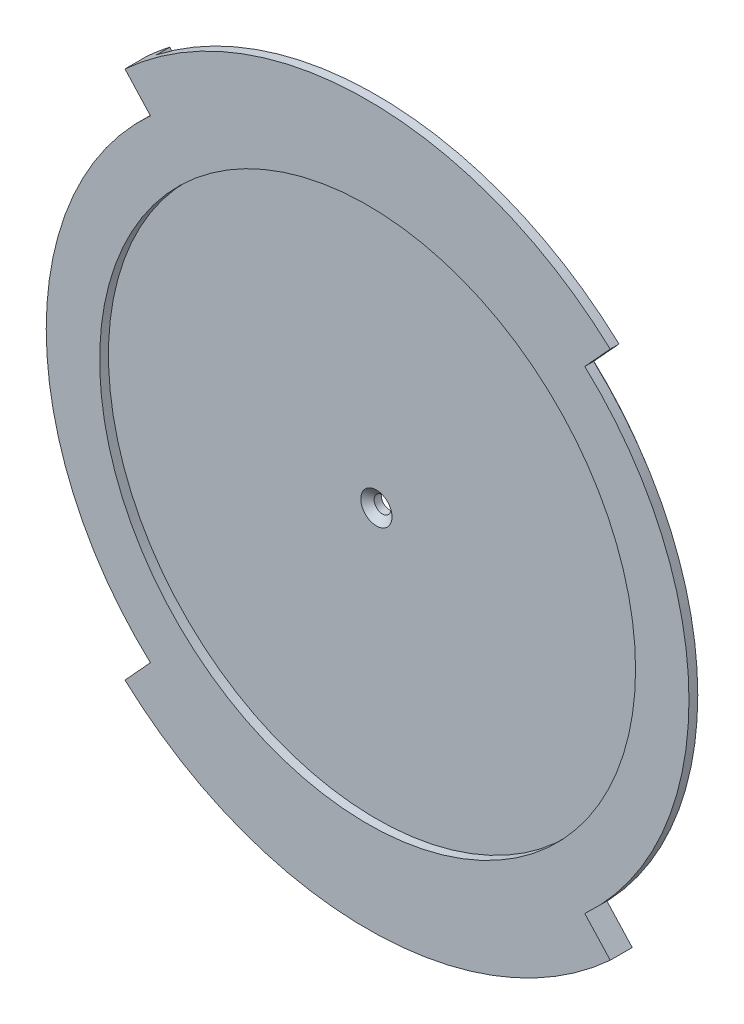
from build123d import *
from build123d.topology import SkipClean

# Parameters (mm, degrees)
CSK_FOR_6_FLAT_HEAD_MACHINE_SCREW_100_D           = 3.7973
CSK_FOR_6_FLAT_HEAD_MACHINE_SCREW_100_CSINK_D     = 7.0866
CSK_FOR_6_FLAT_HEAD_MACHINE_SCREW_100_CSINK_ANGLE = 100
CUT_EXTRUDE1_DEPTH                                = 10
CUT_EXTRUDE2_DEPTH                                = 116.409192875
CUT_EXTRUDE2_DEPTH_BACK                           = 116.409192875
BOSS_EXTRUDE1_START                               = -5
BOSS_EXTRUDE1_DEPTH                               = 5
CUT_EXTRUDE3_DEPTH                                = 10


with BuildPart() as part:
    # Sketch1 → Revolve1 (revolve)
    with BuildSketch(Plane(origin=(0, 0, 0), x_dir=(1, 0, 0), z_dir=(0, 1, 0)), mode=Mode.PRIVATE) as revolve1_sk:
        Polygon((-68.83, 3), (-68.83, 0), (-81.53, 0), (-81.53, -2), (-68.83, -2), (-60.848940548, -2), (-60.848940548, 0), (0, 0), (0, 3), align=None)
    revolve(revolve1_sk.sketch.rotate(Axis((0, 0, 0), (0, 0, -1)), 180), axis=Axis((0, 0, 0), (0, 0, -1)))

    # CSK for #6 Flat Head Machine Screw (100)1 (through all)
    with Locations(Plane(origin=(0, 0.307599269, 0), x_dir=(1, 0, 0), z_dir=(0, 0, 1))):
        with Locations((0, 0)):
            CounterSinkHole(CSK_FOR_6_FLAT_HEAD_MACHINE_SCREW_100_D / 2, CSK_FOR_6_FLAT_HEAD_MACHINE_SCREW_100_CSINK_D / 2, counter_sink_angle=CSK_FOR_6_FLAT_HEAD_MACHINE_SCREW_100_CSINK_ANGLE)

    # Sketch5 → Cut-Extrude1 (cut)
    with BuildSketch(Plane(origin=(0, 0, 0), x_dir=(-1, 0, 0), z_dir=(0, 0, -1))):
        with BuildLine():
            Line((-49.321326643, 53.791143678), (-57.904237692, 63.151893537))
            ThreePointArc((-57.904237692, 63.151893537), (-85.68, 0), (-57.904237692, -63.151893537))
            Line((-57.904237692, -63.151893537), (-49.321326643, -53.791143678))
            ThreePointArc((-49.321326643, -53.791143678), (-72.98, 0), (-49.321326643, 53.791143678))
        make_face()
    extrude(amount=-CUT_EXTRUDE1_DEPTH, mode=Mode.SUBTRACT)

    # Sketch6 → Cut-Extrude2 (cut, two sides: drawn at the far end of the back side and taken through both)
    with BuildSketch(Plane.XY.offset(2).offset(-CUT_EXTRUDE2_DEPTH_BACK)):
        with BuildLine():
            Line((-54.761675773, 59.724532368), (-49.321326643, 53.791143678))
            ThreePointArc((-49.321326643, 53.791143678), (-72.98, 0), (-49.321326643, -53.791143678))
            Line((-49.321326643, -53.791143678), (-54.761675773, -59.724532368))
            ThreePointArc((-54.761675773, -59.724532368), (-81.03, 0), (-54.761675773, 59.724532368))
        make_face()
    extrude(amount=CUT_EXTRUDE2_DEPTH + CUT_EXTRUDE2_DEPTH_BACK, mode=Mode.SUBTRACT)

    # Sketch7 → Boss-Extrude1 (add)
    with SkipClean():  # the faces are left unmerged after this step: merging them gives an invalid solid
        with BuildSketch(Plane.XY.offset(2).offset(BOSS_EXTRUDE1_START)):
            with BuildLine():
                Line((49.321326643, -53.791143678), (55.099585656, -60.093065827))
                ThreePointArc((55.099585656, -60.093065827), (52.554806839, -62.330836495), (49.919235, -64.460925195))
                Line((49.919235, -64.460925195), (44.684236113, -57.700948372))
                ThreePointArc((44.684236113, -57.700948372), (47.043417185, -55.794240738), (49.321326643, -53.791143678))
            make_face()
            with BuildLine():
                Line((-44.684236113, 57.700948372), (-49.919235, 64.460925195))
                ThreePointArc((-49.919235, 64.460925195), (-52.554806839, 62.330836495), (-55.099585656, 60.093065827))
                Line((-55.099585656, 60.093065827), (-49.321326643, 53.791143678))
                ThreePointArc((-49.321326643, 53.791143678), (-47.043417185, 55.794240738), (-44.684236113, 57.700948372))
            make_face()
        extrude(amount=BOSS_EXTRUDE1_DEPTH)

    # Sketch9 → Cut-Extrude3 (cut)
    with BuildSketch(Plane.XY.offset(2)):
        with BuildLine():
            Line((-54.761675773, 59.724532368), (-55.099585656, 60.093065827))
            ThreePointArc((-55.099585656, 60.093065827), (-81.53, 0), (-55.099585656, -60.093065827))
            Line((-55.099585656, -60.093065827), (-54.761675773, -59.724532368))
            ThreePointArc((-54.761675773, -59.724532368), (-81.03, 0), (-54.761675773, 59.724532368))
        make_face()
    extrude(amount=-CUT_EXTRUDE3_DEPTH, mode=Mode.SUBTRACT)


solid = part.part
